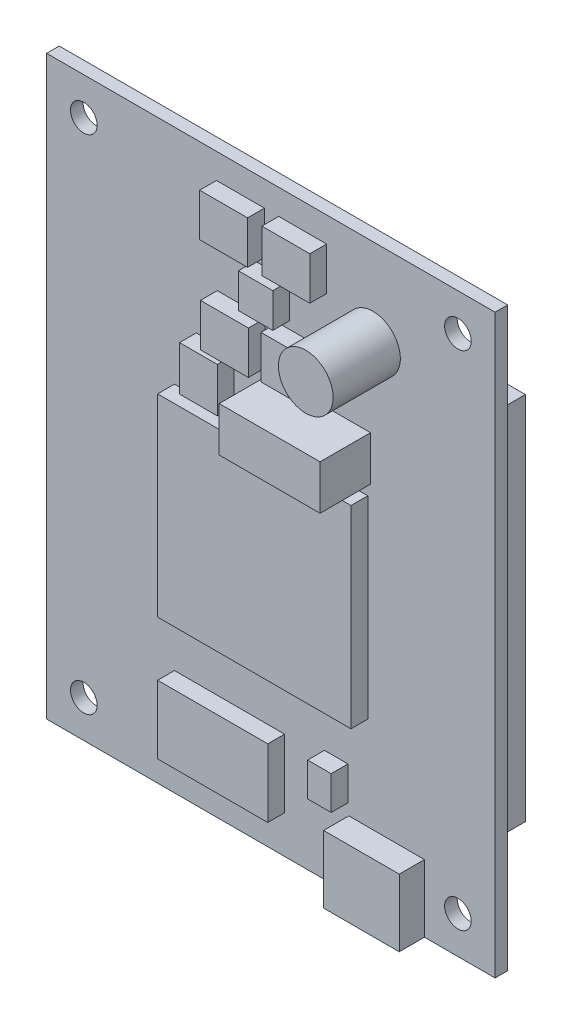
from build123d import *

# Parameters (mm, degrees)
SKETCH_1_W      = 53.34
SKETCH_1_H      = 68.58
SKETCH_1_R      = 1.585
EXTRUDE_1_DEPTH = 1.5
SKETCH_2_R      = 3.25
EXTRUDE_2_DEPTH = 8
SKETCH_3_W      = 12
SKETCH_3_H      = 5.3
EXTRUDE_3_DEPTH = 6
SKETCH_4_W      = 2.8
SKETCH_4_H      = 4
EXTRUDE_4_DEPTH = 2
SKETCH_5_W      = 4.8
SKETCH_5_H      = 44
EXTRUDE_5_DEPTH = 4
SKETCH_6_W      = 9
SKETCH_6_H      = 8
EXTRUDE_6_DEPTH = 3
SKETCH_7_W      = 13.1
SKETCH_7_H      = 8.1
SKETCH_7_W_2    = 4.5
SKETCH_7_H_2    = 5.3
SKETCH_7_W_3    = 5.7
SKETCH_7_H_3    = 5.1
SKETCH_7_W_4    = 4.1
SKETCH_7_H_4    = 4.1
SKETCH_7_W_5    = 23
SKETCH_7_H_5    = 23
EXTRUDE_7_DEPTH = 2


with BuildPart() as part:
    # 草图1 → 凸台-拉伸1 (new body)
    with BuildSketch(Plane.XY):
        with Locations((26.67, 34.29)):
            Rectangle(SKETCH_1_W, SKETCH_1_H)
        with Locations((48.92, 64.16)):
            Circle(SKETCH_1_R, mode=Mode.SUBTRACT)
        with Locations((4.42, 64.16)):
            Circle(SKETCH_1_R, mode=Mode.SUBTRACT)
        with Locations((4.42, 4.42)):
            Circle(SKETCH_1_R, mode=Mode.SUBTRACT)
        with Locations((48.92, 4.42)):
            Circle(SKETCH_1_R, mode=Mode.SUBTRACT)
    extrude(amount=EXTRUDE_1_DEPTH)

    # 草图2 → 凸台-拉伸2 (add)
    with BuildSketch(Plane.XY.offset(1.5)):
        with Locations(Location((38.82, 58.16, 0), (0, 0, 180))):
            Circle(SKETCH_2_R)
    extrude(amount=EXTRUDE_2_DEPTH)

    # 草图3 → 凸台-拉伸3 (add)
    with BuildSketch(Plane.XY.offset(1.5)):
        with Locations((32.52, 46.11)):
            Rectangle(SKETCH_3_W, SKETCH_3_H)
    extrude(amount=EXTRUDE_3_DEPTH)

    # 草图4 → 凸台-拉伸4 (add)
    with BuildSketch(Plane.XY.offset(1.5)):
        with Locations((34.44, 11.3)):
            Rectangle(SKETCH_4_W, SKETCH_4_H)
    extrude(amount=EXTRUDE_4_DEPTH)

    # 草图5 → 凸台-拉伸5 (add)
    with BuildSketch(Plane(origin=(0, 0, 0), x_dir=(-1, 0, 0), z_dir=(0, 0, -1))):
        with Locations((-49.04, 34.4)):
            Rectangle(SKETCH_5_W, SKETCH_5_H)
        with Locations((-4.3, 34.4)):
            Rectangle(SKETCH_5_W, SKETCH_5_H)
    extrude(amount=EXTRUDE_5_DEPTH)

    # 草图6 → 凸台-拉伸6 (add)
    with BuildSketch(Plane.XY.offset(1.5)):
        with Locations((40.44, 4)):
            Rectangle(SKETCH_6_W, SKETCH_6_H)
    extrude(amount=EXTRUDE_6_DEPTH)

    # 草图7 → 凸台-拉伸7 (add)
    with BuildSketch(Plane.XY.offset(1.5)):
        with Locations((21.75, 8.55)):
            Rectangle(SKETCH_7_W, SKETCH_7_H)
        with Locations((20.05, 46.03)):
            Rectangle(SKETCH_7_W_2, SKETCH_7_H_2)
        with Locations((23.05, 63.03)):
            Rectangle(SKETCH_7_W_3, SKETCH_7_H_3)
        with Locations((30.45, 63.03)):
            Rectangle(SKETCH_7_W_3, SKETCH_7_H_3)
        with Locations((23.15, 51.73)):
            Rectangle(SKETCH_7_W_3, SKETCH_7_H_3)
        with Locations((30.35, 52.03)):
            Rectangle(SKETCH_7_W_3, SKETCH_7_H_3)
        with Locations((26.85, 57.53)):
            Rectangle(SKETCH_7_W_4, SKETCH_7_H_4)
        with Locations((26.7, 30.6)):
            Rectangle(SKETCH_7_W_5, SKETCH_7_H_5)
    extrude(amount=EXTRUDE_7_DEPTH)


solid = part.part
